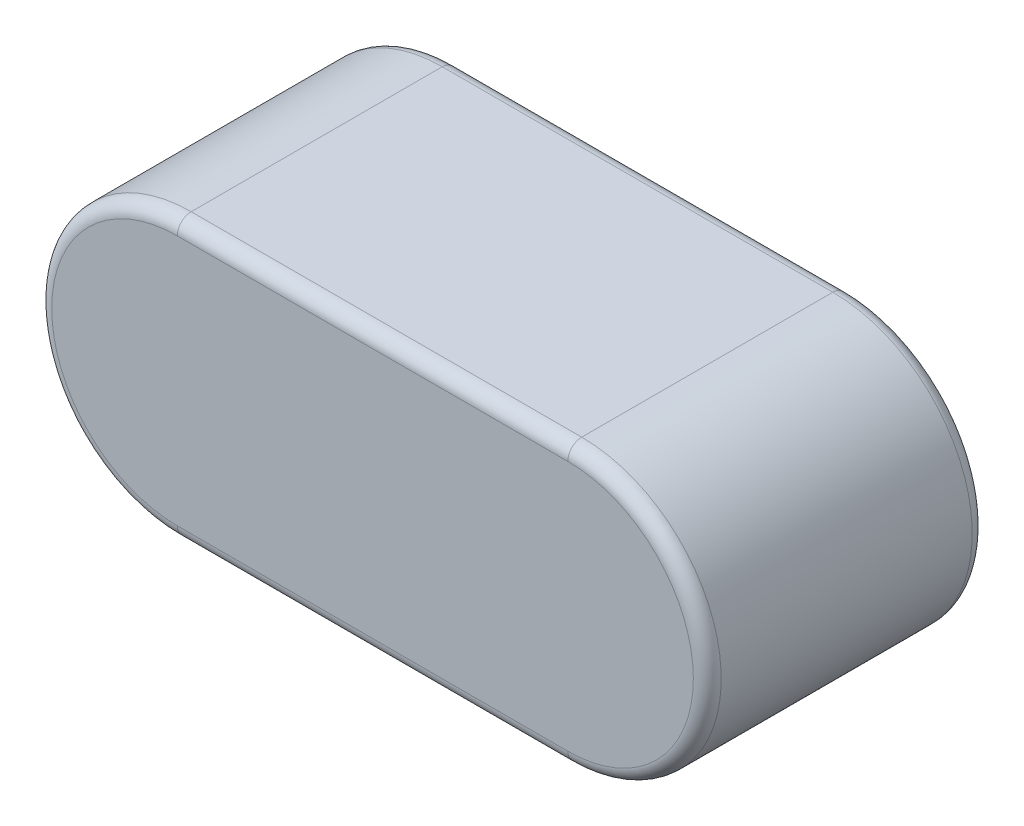
from build123d import *

# Parameters (mm, degrees)
BOSS_EXTRUDE1_DEPTH = 5
FILLET1_R           = 0.25


with BuildPart() as part:
    # Sketch1 → Boss-Extrude1 (new body)
    with BuildSketch(Plane.XY):
        with BuildLine():
            ThreePointArc((0, 5), (-2.5, 2.5), (0, 0))
            Line((0, 0), (0, 5))
        make_face()
        with BuildLine():
            Line((0, 5), (0, 0))
            ThreePointArc((0, 0), (1.767766953, 0.732233047), (2.5, 2.5))
            ThreePointArc((2.5, 2.5), (1.767766953, 4.267766953), (0, 5))
        make_face()
        with BuildLine():
            ThreePointArc((2.5, 2.5), (1.767766953, 0.732233047), (0, 0))
            Line((0, 0), (7, 0))
            ThreePointArc((7, 0), (4.5, 2.5), (7, 5))
            Line((7, 5), (0, 5))
            ThreePointArc((0, 5), (1.767766953, 4.267766953), (2.5, 2.5))
        make_face()
        with BuildLine():
            ThreePointArc((7, 5), (4.5, 2.5), (7, 0))
            Line((7, 0), (7, 5))
        make_face()
        with BuildLine():
            Line((7, 5), (7, 0))
            ThreePointArc((7, 0), (8.767766953, 0.732233047), (9.5, 2.5))
            ThreePointArc((9.5, 2.5), (8.767766953, 4.267766953), (7, 5))
        make_face()
    extrude(amount=BOSS_EXTRUDE1_DEPTH)

    # Fillet1
    fillet1_edges = [part.edges().sort_by_distance(p)[0] for p in [
        (3.5, 0, 5),
        (9.5, 2.5, 5),
        (3.5, 5, 5),
        (-2.5, 2.5, 5),
        (3.5, 5, 0),
        (9.5, 2.5, 0),
        (3.5, 0, 0),
        (-2.5, 2.5, 0),
    ]]
    fillet(fillet1_edges, radius=FILLET1_R)


solid = part.part
